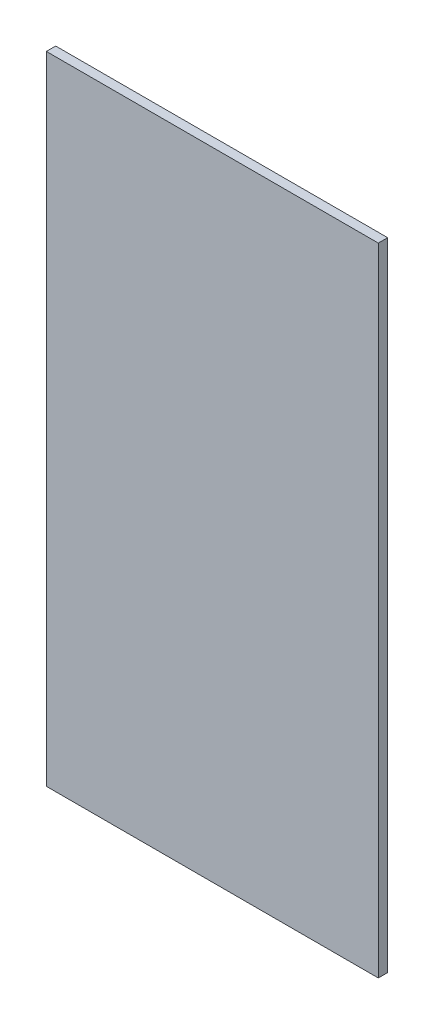
from build123d import *

# Parameters (mm, degrees)
CROQUIS1_W              = 354.7
CROQUIS1_H              = 680
SALIENTE_EXTRUIR1_DEPTH = 10


with BuildPart() as part:
    # Croquis1 → Saliente-Extruir1 (new body)
    with BuildSketch(Plane.XY):
        Rectangle(CROQUIS1_W, CROQUIS1_H)
    extrude(amount=SALIENTE_EXTRUIR1_DEPTH)


solid = part.part
